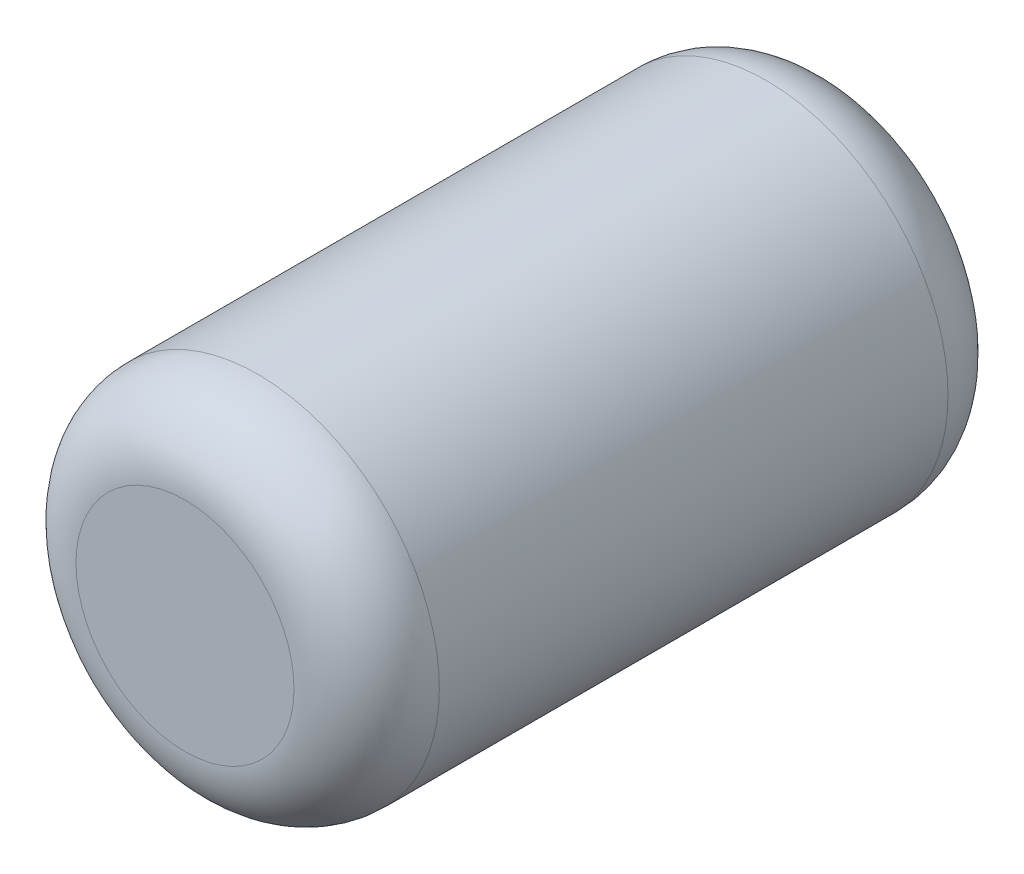
from build123d import *

# Parameters (mm, degrees)
SKETCH1_R           = 63.5
BOSS_EXTRUDE1_DEPTH = 228.6
FILLET1_R           = 25.4


with BuildPart() as part:
    # Sketch1 → Boss-Extrude1 (new body)
    with BuildSketch(Plane.XY):
        Circle(SKETCH1_R)
    extrude(amount=BOSS_EXTRUDE1_DEPTH)

    # Fillet1
    fillet1_edges = [part.edges().sort_by_distance(p)[0] for p in [
        (-63.5, 0, 0),
        (-63.5, 0, 228.6),
    ]]
    fillet(fillet1_edges, radius=FILLET1_R)


solid = part.part
